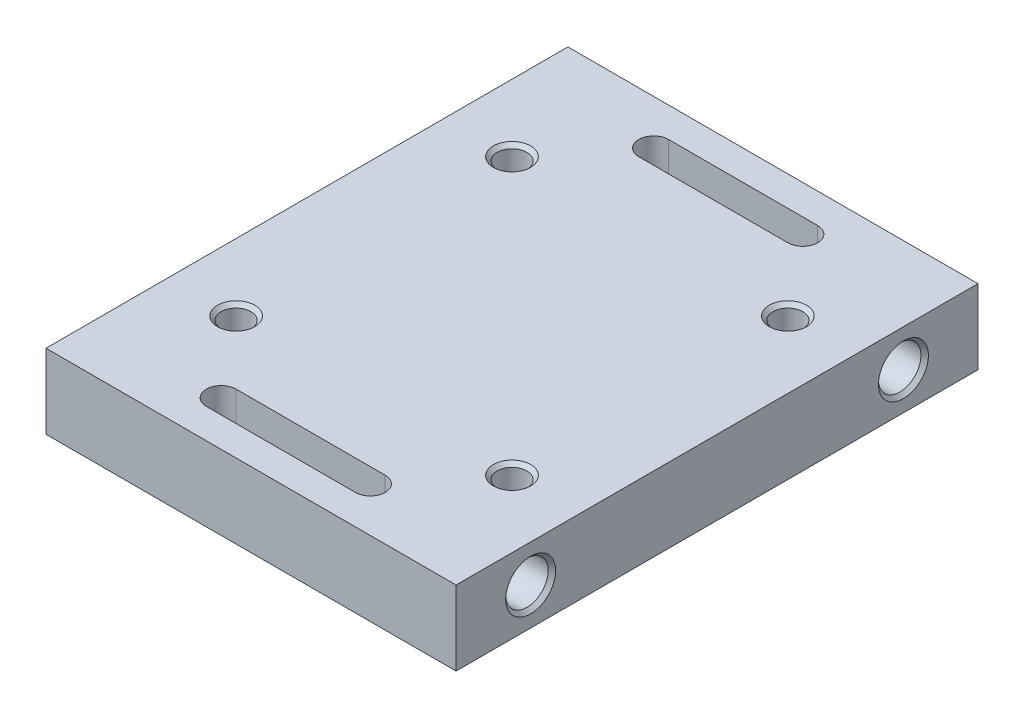
from build123d import *

# Parameters (mm, degrees)
SKETCH1_W           = 55
SKETCH1_H           = 70
SKETCH1_R           = 2
BOSS_EXTRUDE1_DEPTH = 5
SKETCH2_R           = 2.85
CUT_EXTRUDE1_DEPTH  = 8
CHAMFER1_SIZE       = 0.5


with BuildPart() as part:
    # Sketch1 → Boss-Extrude1 (new, symmetric)
    with BuildSketch(Plane(origin=(0, 0, 0), x_dir=(1, 0, 0), z_dir=(0, 1, 0))):
        Rectangle(SKETCH1_W, SKETCH1_H)
        with Locations(Location((18.5, -18.5, 0), (0, 0, 270))):
            Circle(SKETCH1_R, mode=Mode.SUBTRACT)
        with Locations(Location((-18.5, -18.5, 0), (0, 0, 270))):
            Circle(SKETCH1_R, mode=Mode.SUBTRACT)
        with Locations(Location((18.5, 18.5, 0), (0, 0, 270))):
            Circle(SKETCH1_R, mode=Mode.SUBTRACT)
        with Locations(Location((-18.5, 18.5, 0), (0, 0, 270))):
            Circle(SKETCH1_R, mode=Mode.SUBTRACT)
        with BuildLine():
            Line((-10, 27), (10, 27))
            ThreePointArc((10, 27), (12, 29), (10, 31))
            Line((10, 31), (-10, 31))
            ThreePointArc((-10, 31), (-12, 29), (-10, 27))
        make_face(mode=Mode.SUBTRACT)
        with BuildLine():
            Line((-10, -31), (10, -31))
            ThreePointArc((10, -31), (12, -29), (10, -27))
            Line((10, -27), (-10, -27))
            ThreePointArc((-10, -27), (-12, -29), (-10, -31))
        make_face(mode=Mode.SUBTRACT)
    extrude(amount=BOSS_EXTRUDE1_DEPTH, both=True)

    # Sketch2 → Cut-Extrude1 (cut)
    with BuildSketch(Plane(origin=(27.5, 0, 0), x_dir=(0, 0, -1), z_dir=(1, 0, 0))):
        with Locations((-25, 0)):
            Circle(SKETCH2_R)
        with Locations(Location((25, 0, 0), (0, 0, 180))):
            Circle(SKETCH2_R)
    cut_extrude1 = extrude(amount=-CUT_EXTRUDE1_DEPTH, mode=Mode.SUBTRACT)

    # Mirror1: Cut-Extrude1 across plane
    add(cut_extrude1.mirror(Plane(origin=(0, 0, 0), x_dir=(0, 0, 1), z_dir=(1, 0, 0))), mode=Mode.SUBTRACT)

    # Chamfer1
    chamfer1_edges = [part.edges().sort_by_distance(p)[0] for p in [
        (-18.5, 5, 16.5),
        (18.5, 5, -20.5),
        (18.5, 5, 16.5),
        (-18.5, 5, -20.5),
        (27.5, 0, 27.85),
        (27.5, 0, -27.85),
        (-27.5, 0, 27.85),
        (-27.5, 0, -27.85),
    ]]
    chamfer(chamfer1_edges, length=CHAMFER1_SIZE)


solid = part.part
